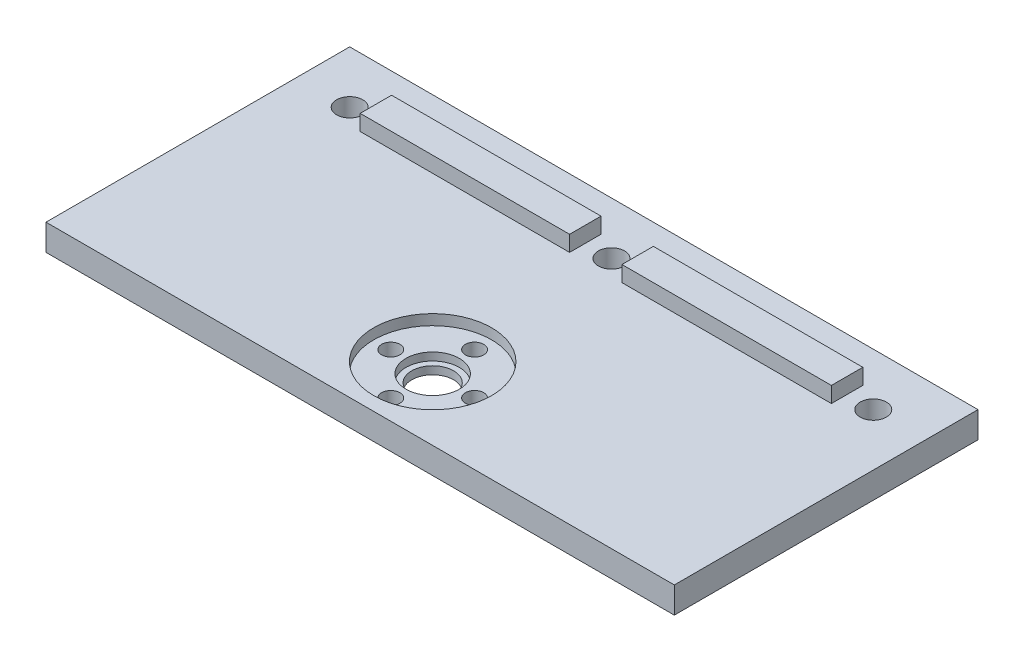
from build123d import *

# Parameters (mm, degrees)
SKETCH1_W           = 120
SKETCH1_H           = 58
BOSS_EXTRUDE5_DEPTH = 5
SKETCH5_R           = 2.5
CUT_EXTRUDE2_DEPTH  = 5
SKETCH6_W           = 40
SKETCH6_H           = 6
BOSS_EXTRUDE6_DEPTH = 3
SKETCH7_R           = 11.25
CUT_EXTRUDE3_DEPTH  = 2
SKETCH8_R           = 4
CUT_EXTRUDE4_DEPTH  = 12
SKETCH9_R           = 5.1
CUT_EXTRUDE5_DEPTH  = 1.5
SKETCH10_R          = 1.75
CUT_EXTRUDE6_DEPTH  = 21.5


with BuildPart() as part:
    # Sketch1 → Boss-Extrude5 (new body)
    with BuildSketch(Plane(origin=(0, 0, 0), x_dir=(1, 0, 0), z_dir=(0, 1, 0))):
        with Locations((60, 29)):
            Rectangle(SKETCH1_W, SKETCH1_H)
    extrude(amount=BOSS_EXTRUDE5_DEPTH)

    # Sketch5 → Cut-Extrude2 (cut)
    with BuildSketch(Plane(origin=(0, 5, 0), x_dir=(1, 0, 0), z_dir=(0, 1, 0))):
        with Locations(Location((10, 48, 0), (0, 0, 270))):
            Circle(SKETCH5_R)
        with Locations(Location((60, 48, 0), (0, 0, 270))):
            Circle(SKETCH5_R)
        with Locations(Location((110, 48, 0), (0, 0, 270))):
            Circle(SKETCH5_R)
    extrude(amount=-CUT_EXTRUDE2_DEPTH, mode=Mode.SUBTRACT)

    # Sketch6 → Boss-Extrude6 (add)
    with BuildSketch(Plane(origin=(0, 5, 0), x_dir=(1, 0, 0), z_dir=(0, 1, 0))):
        with Locations((35, 48)):
            Rectangle(SKETCH6_W, SKETCH6_H)
        with Locations((85, 48)):
            Rectangle(SKETCH6_W, SKETCH6_H)
    extrude(amount=BOSS_EXTRUDE6_DEPTH)

    # Sketch7 → Cut-Extrude3 (cut)
    with BuildSketch(Plane(origin=(0, 5, 0), x_dir=(1, 0, 0), z_dir=(0, 1, 0))):
        with Locations(Location((60, 13.85, 0), (0, 0, 270))):
            Circle(SKETCH7_R)
    extrude(amount=-CUT_EXTRUDE3_DEPTH, mode=Mode.SUBTRACT)

    # Sketch8 → Cut-Extrude4 (cut)
    with BuildSketch(Plane(origin=(0, 3, 0), x_dir=(1, 0, 0), z_dir=(0, 1, 0))):
        with Locations(Location((60, 13.85, 0), (0, 0, 270))):
            Circle(SKETCH8_R)
    extrude(amount=-CUT_EXTRUDE4_DEPTH, mode=Mode.SUBTRACT)

    # Sketch9 → Cut-Extrude5 (cut)
    with BuildSketch(Plane(origin=(0, 3, 0), x_dir=(1, 0, 0), z_dir=(0, 1, 0))):
        with Locations(Location((60, 13.85, 0), (0, 0, 270))):
            Circle(SKETCH9_R)
    extrude(amount=-CUT_EXTRUDE5_DEPTH, mode=Mode.SUBTRACT)

    # Sketch10 → Cut-Extrude6 (cut)
    with BuildSketch(Plane(origin=(0, 3, 0), x_dir=(1, 0, 0), z_dir=(0, 1, 0))):
        with Locations(Location((52, 13.85, 0), (0, 0, 270))):
            Circle(SKETCH10_R)
        with Locations(Location((60, 21.85, 0), (0, 0, 270))):
            Circle(SKETCH10_R)
        with Locations(Location((68, 13.85, 0), (0, 0, 270))):
            Circle(SKETCH10_R)
        with Locations(Location((60, 5.85, 0), (0, 0, 270))):
            Circle(SKETCH10_R)
    extrude(amount=-CUT_EXTRUDE6_DEPTH, mode=Mode.SUBTRACT)


solid = part.part
